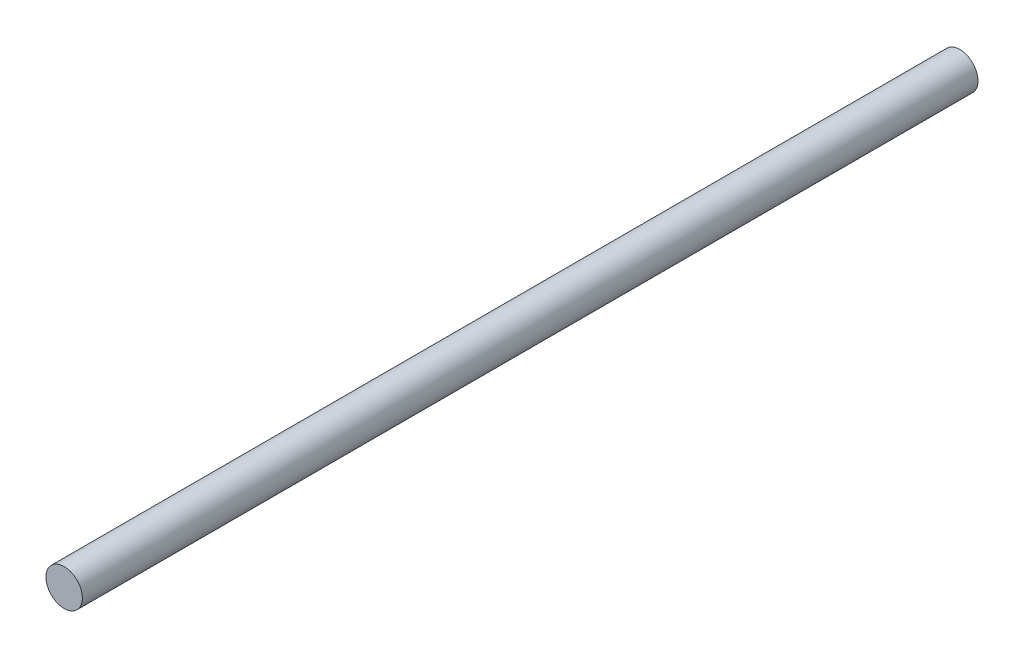
from build123d import *

# Parameters (mm, degrees)
SKETCH_1_R  = 3.8
CABLE_DEPTH = 187


with BuildPart() as part:
    # 草图1 → Cable (new body)
    with BuildSketch(Plane.XY):
        Circle(SKETCH_1_R)
    extrude(amount=CABLE_DEPTH)


solid = part.part
